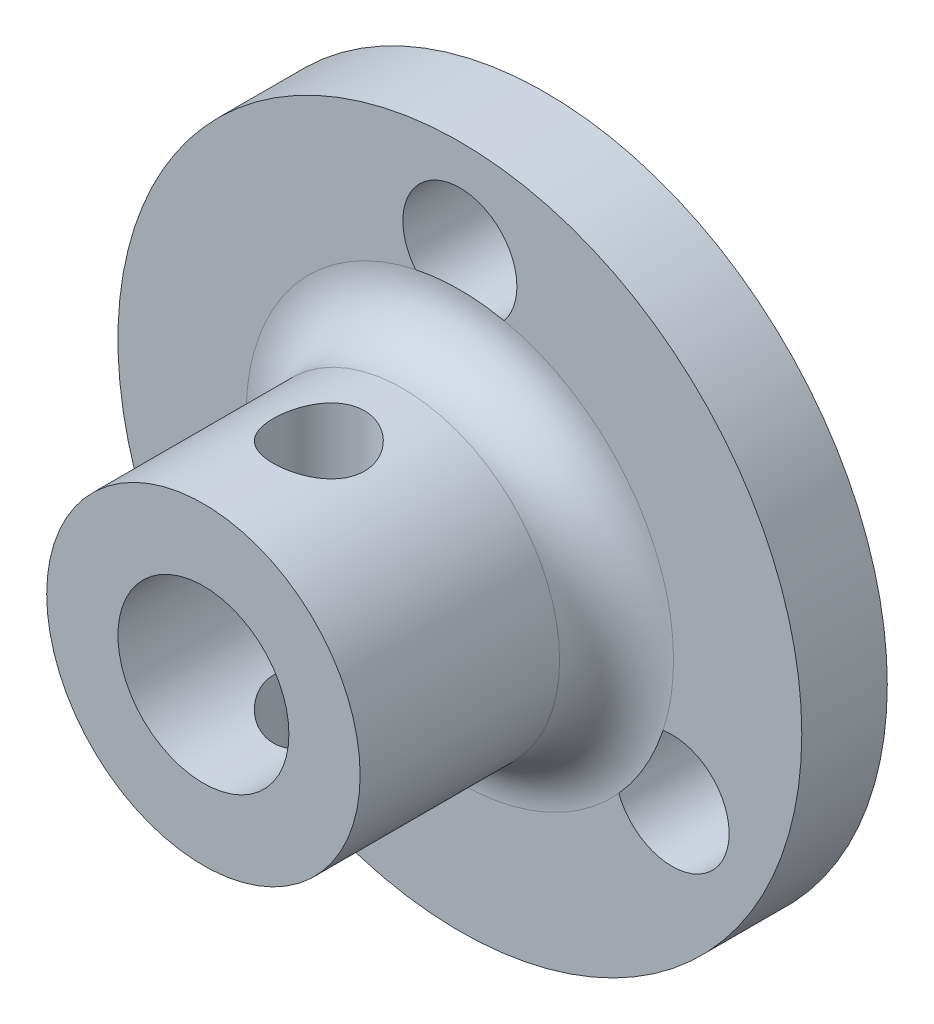
from build123d import *

# Parameters (mm, degrees)
SKETCH1_R           = 12
SKETCH1_R_2         = 5.5
BOSS_EXTRUDE1_DEPTH = 3
SKETCH1_5_R         = 5.5
SKETCH1_5_R_2       = 3
BOSS_EXTRUDE3_DEPTH = 12
FILLET2_R           = 2
CUT_EXTRUDE1_START  = -5.5
SKETCH2_R           = 1.6
CUT_EXTRUDE1_DEPTH  = 11
SKETCH3_R           = 2.001151749
CUT_EXTRUDE2_DEPTH  = 4


with BuildPart() as part:
    # Sketch1 → Boss-Extrude1 (new body)
    with BuildSketch(Plane.XY):
        Circle(SKETCH1_R)
        Circle(SKETCH1_R_2, mode=Mode.SUBTRACT)
    extrude(amount=BOSS_EXTRUDE1_DEPTH)

    # Sketch1<5> → Boss-Extrude3 (add)
    with BuildSketch(Plane.XY):
        Circle(SKETCH1_5_R)
        Circle(SKETCH1_5_R_2, mode=Mode.SUBTRACT)
    extrude(amount=BOSS_EXTRUDE3_DEPTH)

    # Fillet2
    fillet2_edges = [part.edges().sort_by_distance(p)[0] for p in [
        (-5.5, 0, 3),
    ]]
    fillet(fillet2_edges, radius=FILLET2_R)

    # Sketch2 → Cut-Extrude1 (cut)
    with BuildSketch(Plane(origin=(0, 0, 0), x_dir=(1, 0, 0), z_dir=(0, 1, 0)).offset(CUT_EXTRUDE1_START)):
        with Locations(Location((0, -7.949486667, 0), (0, 0, 90))):
            Circle(SKETCH2_R)
    extrude(amount=CUT_EXTRUDE1_DEPTH, mode=Mode.SUBTRACT)

    # Sketch3 → Cut-Extrude2 (cut)
    with BuildSketch(Plane.XY.offset(3)):
        with Locations((0, 8.599839423)):
            Circle(SKETCH3_R)
        with Locations((7.447679409, -4.299919712)):
            Circle(SKETCH3_R)
        with Locations((-7.447679409, -4.299919712)):
            Circle(SKETCH3_R)
    extrude(amount=-CUT_EXTRUDE2_DEPTH, mode=Mode.SUBTRACT)


solid = part.part
